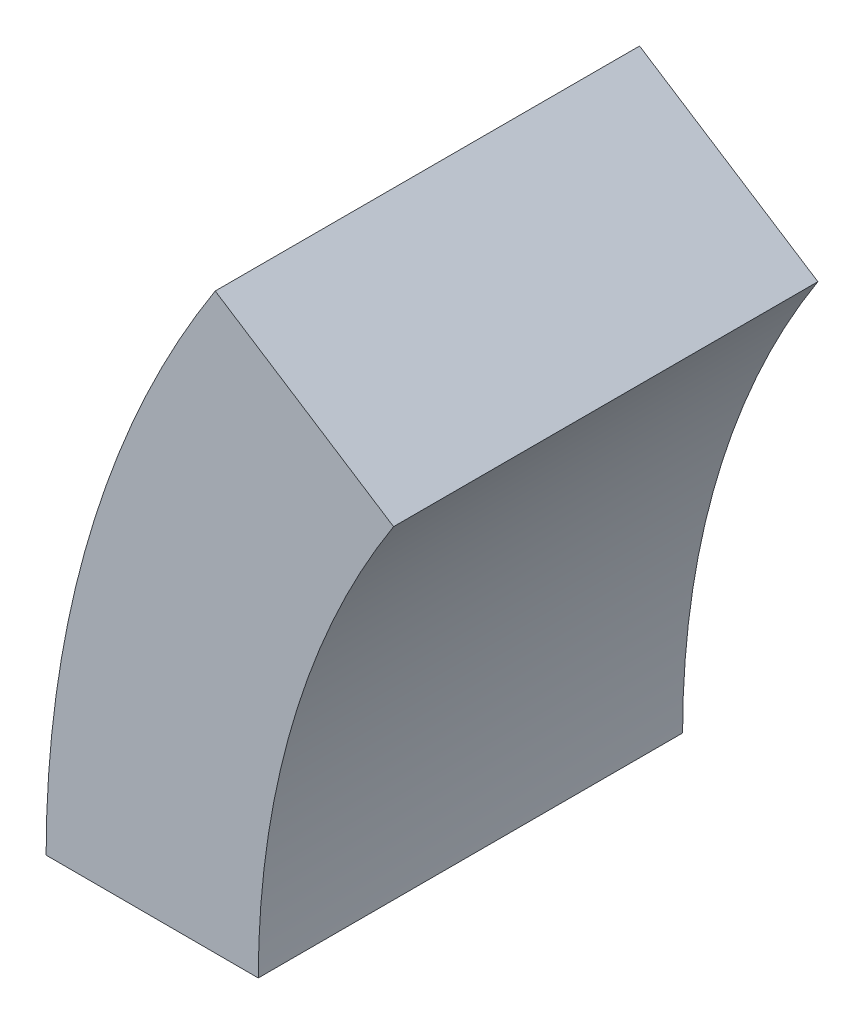
from build123d import *

# Parameters (mm, degrees)
SKETCH1_R           = 63.5
SKETCH1_R_2         = 50.8
BOSS_EXTRUDE1_DEPTH = 25.4
SKETCH2_W           = 45.380209112
SKETCH2_H           = 34.63225072
CUT_REVOLVE1_ANGLE  = 0.08
SKETCH2_2_W         = 45.380209112
SKETCH2_2_H         = 34.63225072
CUT_REVOLVE2_ANGLE  = 327.2


with BuildPart() as part:
    # Sketch1 → Boss-Extrude1 (new body)
    with BuildSketch(Plane.XY):
        Circle(SKETCH1_R)
        Circle(SKETCH1_R_2, mode=Mode.SUBTRACT)
    extrude(amount=BOSS_EXTRUDE1_DEPTH)

    # Sketch2 → Cut-Revolve1 (revolve, cut)
    with BuildSketch(Plane(origin=(0, 0, 0), x_dir=(1, 0, 0), z_dir=(0, 1, 0))):
        with Locations((-63.5, -12.7)):
            Rectangle(SKETCH2_W, SKETCH2_H)
    revolve(axis=Axis((0, 0, 25.4), (0, 0, -1)), revolution_arc=CUT_REVOLVE1_ANGLE, mode=Mode.SUBTRACT)

    # Sketch2<2> → Cut-Revolve2 (revolve, cut)
    with BuildSketch(Plane(origin=(0, 0, 0), x_dir=(1, 0, 0), z_dir=(0, 1, 0))):
        with Locations((-63.5, -12.7)):
            Rectangle(SKETCH2_2_W, SKETCH2_2_H)
    revolve(axis=Axis((0, 0, 25.4), (0, 0, 1)), revolution_arc=CUT_REVOLVE2_ANGLE, mode=Mode.SUBTRACT)


solid = part.part
